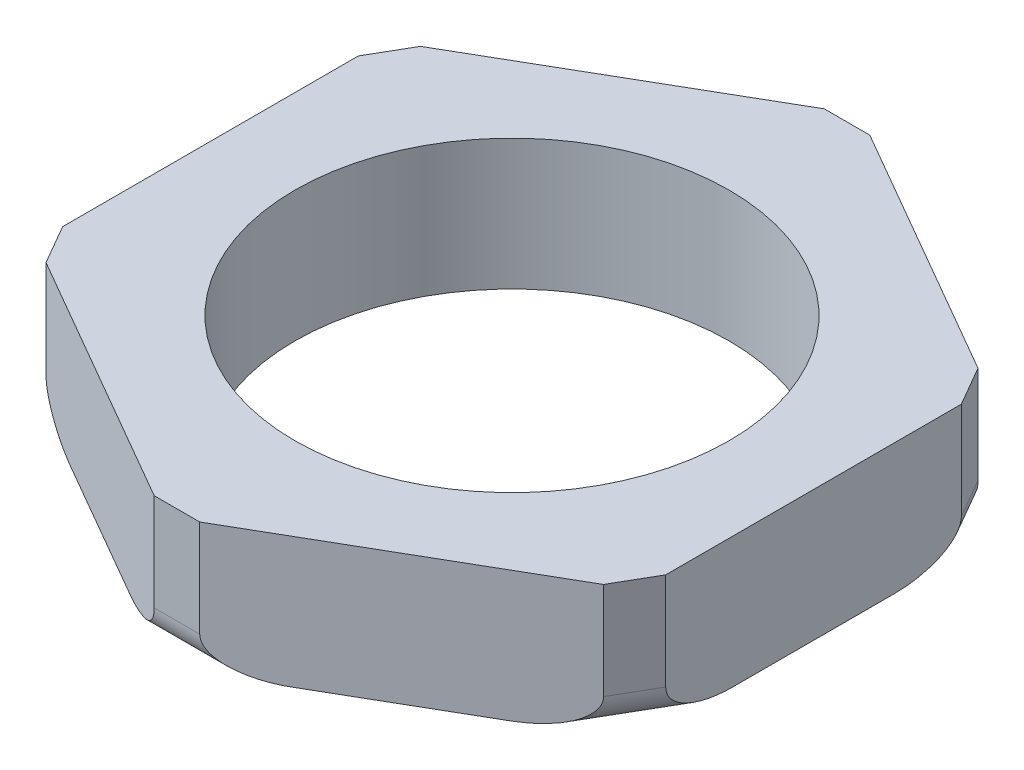
from build123d import *

# Parameters (mm, degrees)
SKETCH_1_R      = 6.48
EXTRUDE_1_DEPTH = 3.9
FILLET_1_R      = 1


with BuildPart() as part:
    # Эскиз1 → Бобышка-Вытянуть1 (new body)
    with BuildSketch(Plane(origin=(0, 0, 0), x_dir=(1, 0, 0), z_dir=(0, 1, 0))):
        Polygon((0.679491924, 10), (8.320508076, 5.588457268), (9, 4.411542732), (9, -4.411542732), (8.320508076, -5.588457268), (0.679491924, -10), (-0.679491924, -10), (-8.320508076, -5.588457268), (-9, -4.411542732), (-9, 4.411542732), (-8.320508076, 5.588457268), (-0.679491924, 10), align=None)
        with Locations(Location((0, 0, 0), (0, 0, 270))):
            Circle(SKETCH_1_R, mode=Mode.SUBTRACT)
    extrude(amount=EXTRUDE_1_DEPTH)

    # Скругление1
    fillet_1_edges = [part.edges().sort_by_distance(p)[0] for p in [
        (-8.660254038, 0, -5),
        (0, 0, -10),
        (8.660254038, 0, -5),
        (8.660254038, 0, 5),
        (0, 0, 10),
        (-8.660254038, 0, 5),
    ]]
    fillet(fillet_1_edges, radius=FILLET_1_R)


solid = part.part
